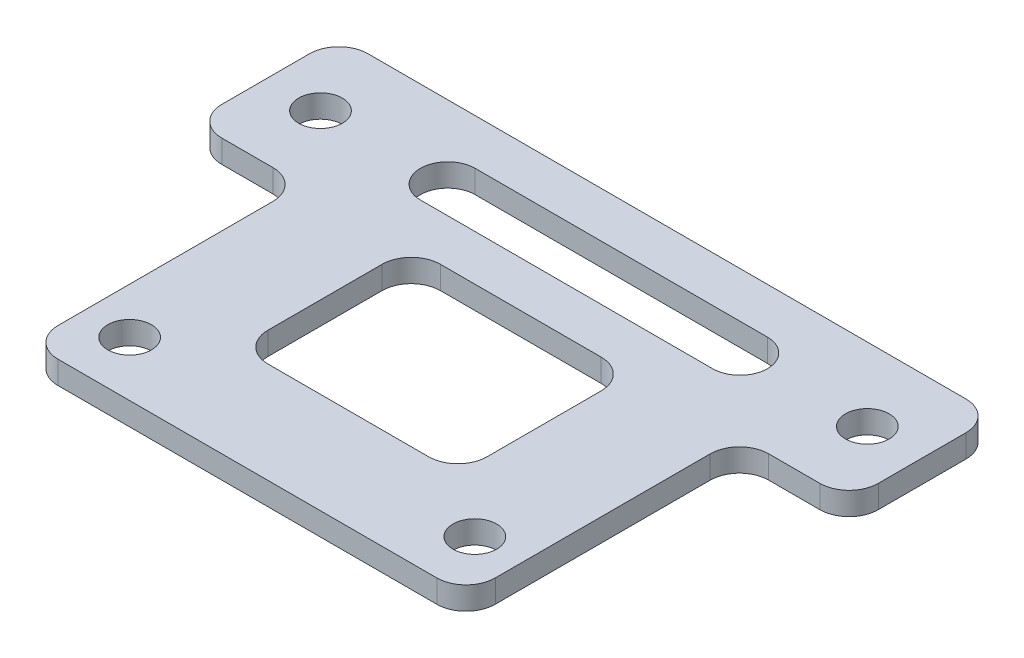
from build123d import *

# Parameters (mm, degrees)
SKETCH2_R           = 1.89865
SKETCH2_W           = 19.05
SKETCH2_H           = 15
BOSS_EXTRUDE1_DEPTH = 1.984375
FILLET1_R           = 2.54


with BuildPart() as part:
    # Sketch2 → Boss-Extrude1 (new body)
    with BuildSketch(Plane(origin=(0, 0, 0), x_dir=(1, 0, 0), z_dir=(0, 1, 0))):
        Polygon((0, 0), (0, 23.7625), (-9.525, 23.7625), (-9.525, 36.4625), (0, 36.4625), (38, 36.4625), (47.525, 36.4625), (47.525, 23.7625), (38, 23.7625), (38, 0), (27.055231083, 0), align=None)
        with Locations(Location((34, 4.7625, 0), (0, 0, 270))):
            Circle(SKETCH2_R, mode=Mode.SUBTRACT)
        with Locations(Location((4, 4.7625, 0), (0, 0, 270))):
            Circle(SKETCH2_R, mode=Mode.SUBTRACT)
        with Locations(Location((-4.7625, 30.1125, 0), (0, 0, 270))):
            Circle(SKETCH2_R, mode=Mode.SUBTRACT)
        with Locations(Location((42.7625, 30.1125, 0), (0, 0, 270))):
            Circle(SKETCH2_R, mode=Mode.SUBTRACT)
        with Locations((19, 16.2625)):
            Rectangle(SKETCH2_W, SKETCH2_H, mode=Mode.SUBTRACT)
        with BuildLine():
            Line((6.3, 32.49375), (31.7, 32.49375))
            ThreePointArc((31.7, 32.49375), (34.08125, 30.1125), (31.7, 27.73125))
            Line((31.7, 27.73125), (6.3, 27.73125))
            ThreePointArc((6.3, 27.73125), (3.91875, 30.1125), (6.3, 32.49375))
        make_face(mode=Mode.SUBTRACT)
    extrude(amount=BOSS_EXTRUDE1_DEPTH)

    # Fillet1
    fillet1_edges = [part.edges().sort_by_distance(p)[0] for p in [
        (0, 0.9921875, 0),
        (0, 0.9921875, -23.7625),
        (-9.525, 0.9921875, -23.7625),
        (-9.525, 0.9921875, -36.4625),
        (47.525, 0.9921875, -36.4625),
        (47.525, 0.9921875, -23.7625),
        (38, 0.9921875, -23.7625),
        (38, 0.9921875, 0),
        (28.525, 0.9921875, -8.7625),
        (28.525, 0.9921875, -23.7625),
        (9.475, 0.9921875, -23.7625),
        (9.475, 0.9921875, -8.7625),
    ]]
    fillet(fillet1_edges, radius=FILLET1_R)


solid = part.part
